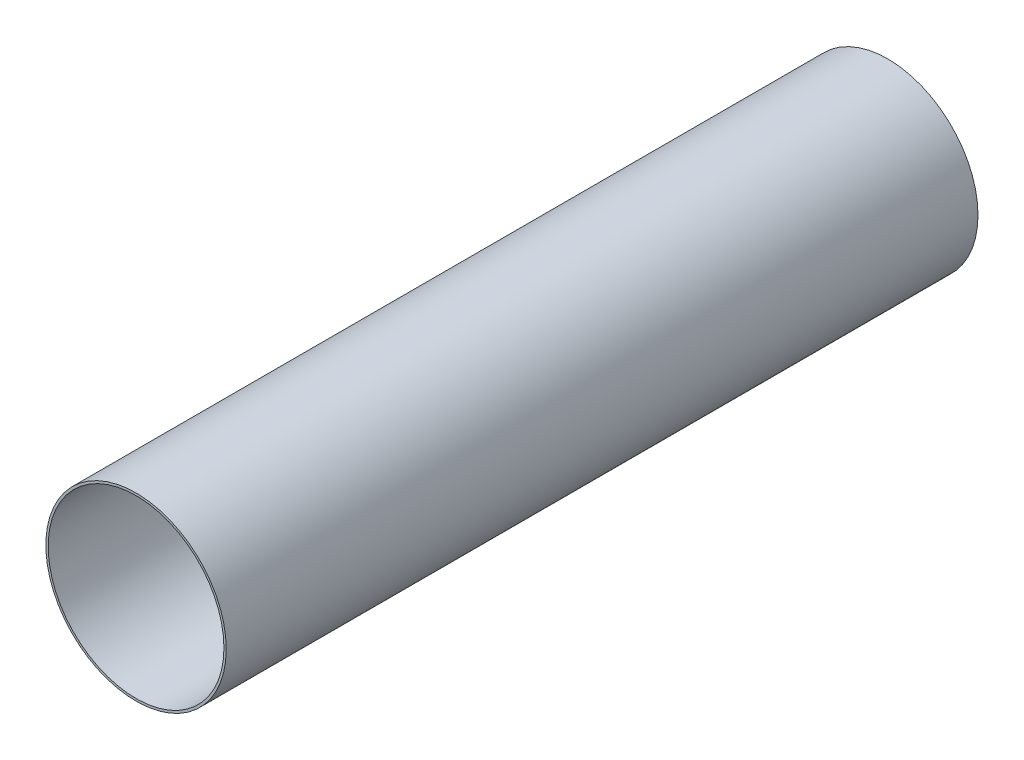
from build123d import *

# Parameters (mm, degrees)
SKETCH1_R           = 78
SKETCH1_R_2         = 76
BOSS_EXTRUDE1_DEPTH = 650


with BuildPart() as part:
    # Sketch1 → Boss-Extrude1 (new body)
    with BuildSketch(Plane.XY):
        Circle(SKETCH1_R)
        Circle(SKETCH1_R_2, mode=Mode.SUBTRACT)
    extrude(amount=BOSS_EXTRUDE1_DEPTH)


solid = part.part
